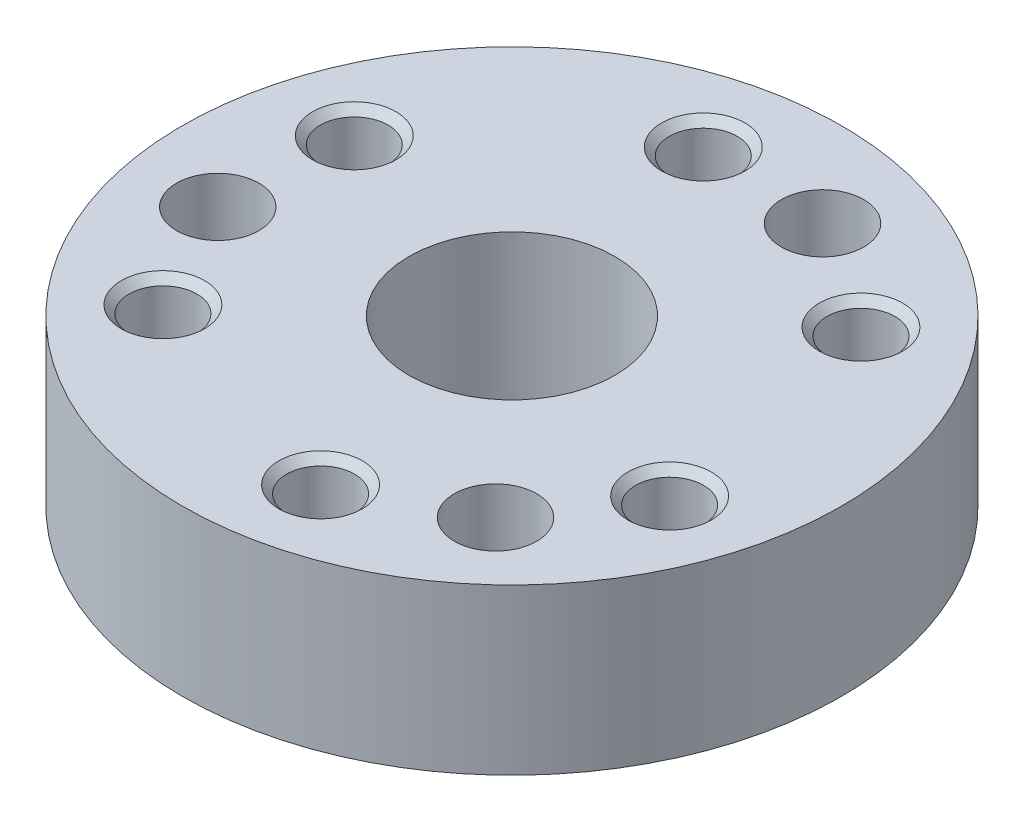
from build123d import *

# Parameters (mm, degrees)
SKETCH_1_R                   = 16
EXTRUDE_1_DEPTH              = 8
HOLE_WIZARD_M4_1_D           = 3.3
HOLE_WIZARD_M4_1_DEPTH       = 6
HOLE_WIZARD_M4_1_CSINK_D     = 4.05
HOLE_WIZARD_M4_1_CSINK_ANGLE = 90
HOLE_WIZARD_M4_1_TIP         = 0.991420021
SKETCH_5_R                   = 2
CUT_EXTRUDE_1_DEPTH          = 8
SKETCH_6_R                   = 5
CUT_EXTRUDE_2_DEPTH          = 8


with BuildPart() as part:
    # 草图1 → 凸台-拉伸1 (new body)
    with BuildSketch(Plane(origin=(0, 0, 0), x_dir=(1, 0, 0), z_dir=(0, 1, 0))):
        with Locations(Location((0, 0, 0), (0, 0, 270))):
            Circle(SKETCH_1_R)
    extrude(amount=EXTRUDE_1_DEPTH)

    # M4 螺纹孔1
    with Locations(Plane(origin=(0, 8, 0), x_dir=(1, 0, 0), z_dir=(0, 1, 0))):
        with Locations((-11.400524182, 3.745403632), (-2.456647399, 11.745845374), (8.943876784, 8.000441742), (11.400524182, -3.745403632), (2.456647399, -11.745845374), (-8.943876784, -8.000441742)):
            CounterSinkHole(HOLE_WIZARD_M4_1_D / 2, HOLE_WIZARD_M4_1_CSINK_D / 2, depth=HOLE_WIZARD_M4_1_DEPTH, counter_sink_angle=HOLE_WIZARD_M4_1_CSINK_ANGLE)
            with Locations((0, 0, -(HOLE_WIZARD_M4_1_DEPTH + HOLE_WIZARD_M4_1_TIP / 2))):  # 118° drill point
                Cone(0, HOLE_WIZARD_M4_1_D / 2, HOLE_WIZARD_M4_1_TIP, mode=Mode.SUBTRACT)

    # 草图5 → 切除-拉伸1 (cut)
    with BuildSketch(Plane(origin=(0, 8, 0), x_dir=(1, 0, 0), z_dir=(0, 1, 0))):
        with Locations(Location((3.646912878, 11.432411227, 0), (0, 0, 270))):
            Circle(SKETCH_5_R)
        with Locations(Location((8.07730211, -8.874524811, 0), (0, 0, 270))):
            Circle(SKETCH_5_R)
        with Locations(Location((-11.724214988, -2.557886415, 0), (0, 0, 270))):
            Circle(SKETCH_5_R)
    extrude(amount=-CUT_EXTRUDE_1_DEPTH, mode=Mode.SUBTRACT)

    # 草图6 → 切除-拉伸2 (cut)
    with BuildSketch(Plane(origin=(0, 8, 0), x_dir=(1, 0, 0), z_dir=(0, 1, 0))):
        with Locations(Location((0, 0, 0), (0, 0, 270))):
            Circle(SKETCH_6_R)
    extrude(amount=-CUT_EXTRUDE_2_DEPTH, mode=Mode.SUBTRACT)


solid = part.part
